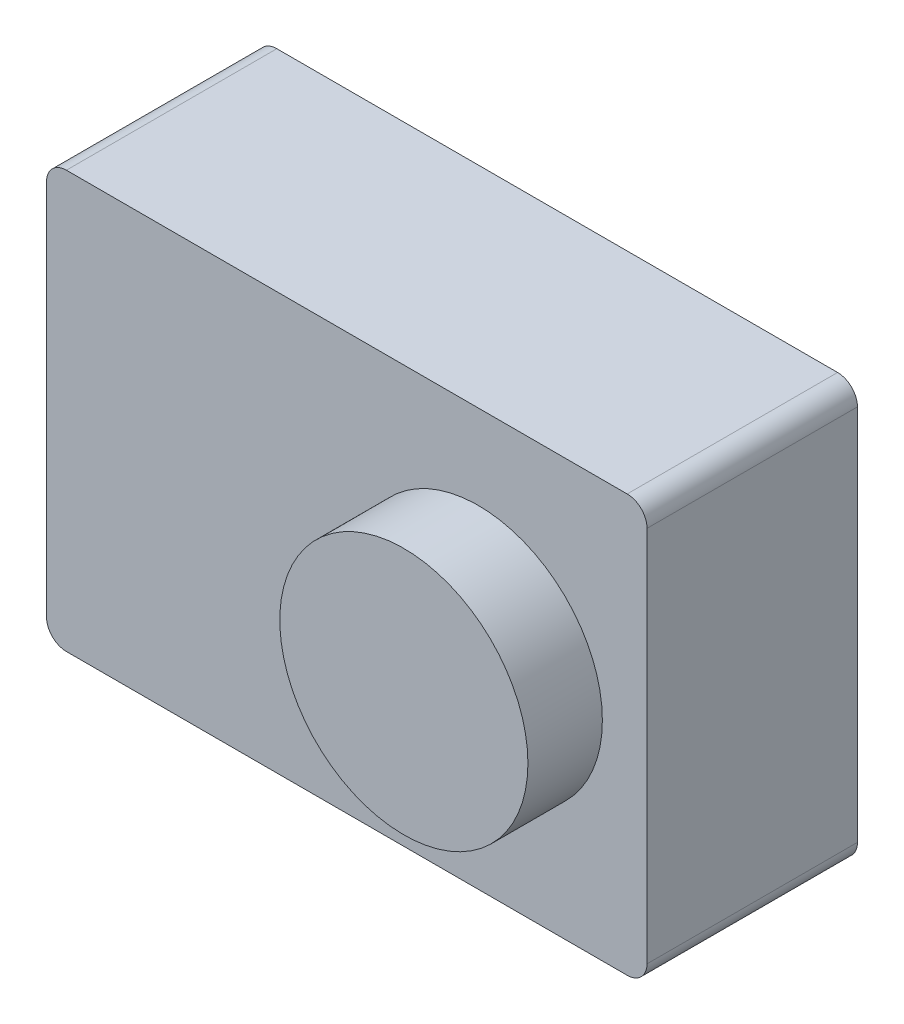
from build123d import *

# Parameters (mm, degrees)
BOSS_EXTRUDE1_DEPTH = 21.2
SKETCH2_R           = 12.5
BOSS_EXTRUDE2_DEPTH = 7.5
SKETCH3_R           = 3
CUT_EXTRUDE1_DEPTH  = 5


with BuildPart() as part:
    # Sketch1 → Boss-Extrude1 (new body)
    with BuildSketch(Plane.XY):
        with BuildLine():
            Line((-28.25, -21), (28.25, -21))
            ThreePointArc((28.25, -21), (29.664213562, -20.414213562), (30.25, -19))
            Line((30.25, -19), (30.25, 19))
            ThreePointArc((30.25, 19), (29.664213562, 20.414213562), (28.25, 21))
            Line((28.25, 21), (-28.25, 21))
            ThreePointArc((-28.25, 21), (-29.664213562, 20.414213562), (-30.25, 19))
            Line((-30.25, 19), (-30.25, -19))
            ThreePointArc((-30.25, -19), (-29.664213562, -20.414213562), (-28.25, -21))
        make_face()
    extrude(amount=BOSS_EXTRUDE1_DEPTH)

    # Sketch2 → Boss-Extrude2 (add)
    with BuildSketch(Plane.XY.offset(21.2)):
        with Locations((13.25, 0)):
            Circle(SKETCH2_R)
    extrude(amount=BOSS_EXTRUDE2_DEPTH)

    # Sketch3 → Cut-Extrude1 (cut)
    with BuildSketch(Plane.XZ.offset(21)):
        with Locations(Location((13.25, 10, 0), (0, 0, 270))):
            Circle(SKETCH3_R)
    extrude(amount=-CUT_EXTRUDE1_DEPTH, mode=Mode.SUBTRACT)


solid = part.part
